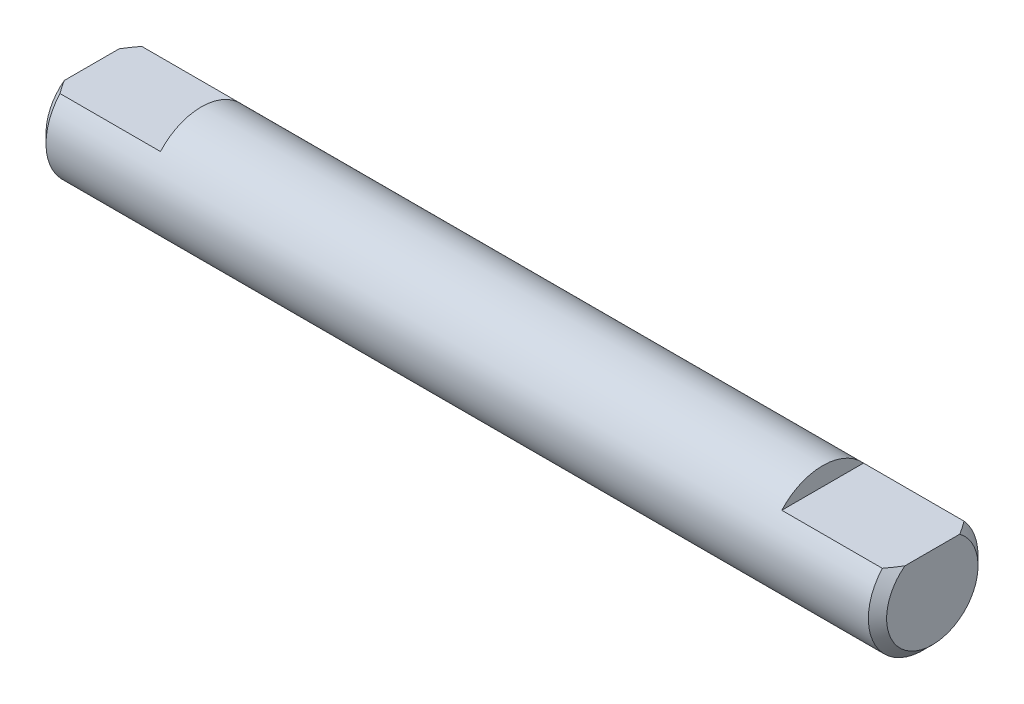
from build123d import *

# Parameters (mm, degrees)
SKETCH1_R           = 3
BOSS_EXTRUDE1_DEPTH = 23
CHAMFER1_SIZE       = 0.5
CUT_EXTRUDE1_DEPTH  = 6


with BuildPart() as part:
    # Sketch1 → Boss-Extrude1 (new, symmetric)
    with BuildSketch(Plane(origin=(0, 0, 0), x_dir=(0, 0, -1), z_dir=(1, 0, 0))):
        Circle(SKETCH1_R)
    extrude(amount=BOSS_EXTRUDE1_DEPTH, both=True)

    # Chamfer1
    chamfer1_edges = [part.edges().sort_by_distance(p)[0] for p in [
        (-23, 0, 3),
        (23, 0, 3),
    ]]
    chamfer(chamfer1_edges, length=CHAMFER1_SIZE)

    # Sketch2 → Cut-Extrude1 (cut)
    with BuildSketch(Plane(origin=(23, 0, 0), x_dir=(0, 0, -1), z_dir=(1, 0, 0))):
        with BuildLine():
            Line((-2.236067977, 2), (2.236067977, 2))
            ThreePointArc((2.236067977, 2), (0, 3), (-2.236067977, 2))
        make_face()
    cut_extrude1 = extrude(amount=-CUT_EXTRUDE1_DEPTH, mode=Mode.SUBTRACT)

    # Mirror1: Cut-Extrude1 across plane
    add(cut_extrude1.mirror(Plane(origin=(0, 0, 0), x_dir=(0, 0, 1), z_dir=(1, 0, 0))), mode=Mode.SUBTRACT)


solid = part.part
